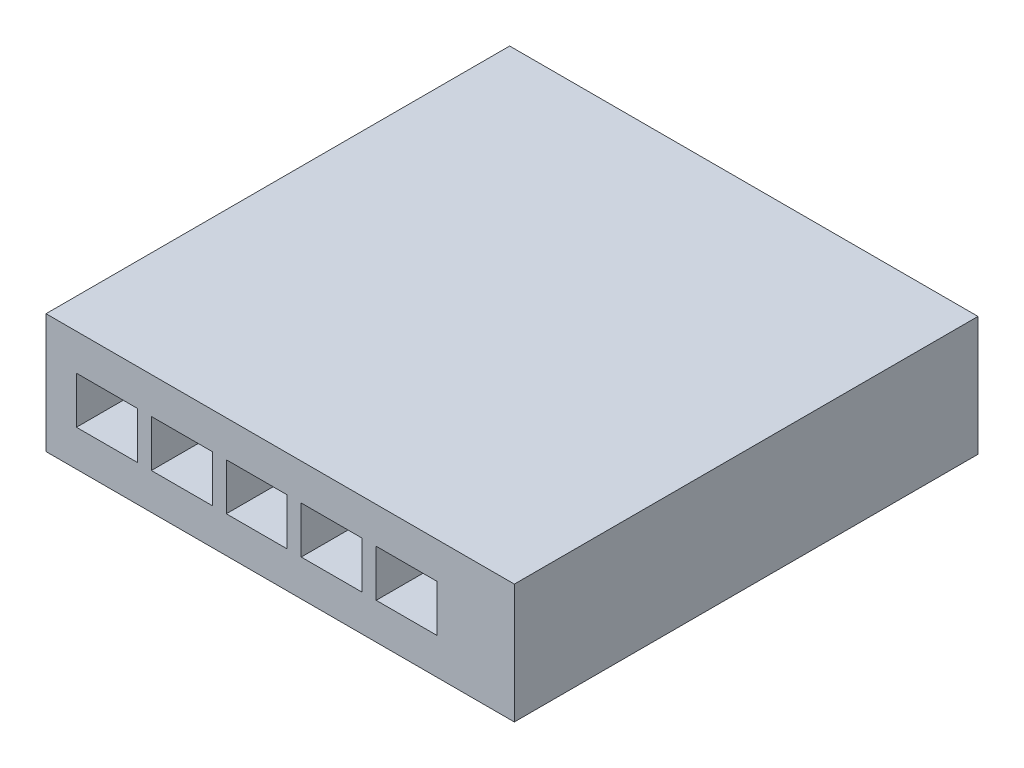
from build123d import *

# Parameters (mm, degrees)
SKETCH1_W           = 100
SKETCH1_H           = 99
BOSS_EXTRUDE1_DEPTH = 12.75
SKETCH2_W           = 13
SKETCH2_H           = 10
CUT_EXTRUDE1_DEPTH  = 20
LPATTERN1_COUNT     = 5
LPATTERN1_PITCH     = 16
SKETCH3_R           = 1.5
CUT_EXTRUDE2_DEPTH  = 10


with BuildPart() as part:
    # Sketch1 → Boss-Extrude1 (new, symmetric)
    with BuildSketch(Plane(origin=(0, 0, 0), x_dir=(1, 0, 0), z_dir=(0, 1, 0))):
        Rectangle(SKETCH1_W, SKETCH1_H)
    extrude(amount=BOSS_EXTRUDE1_DEPTH, both=True)

    # Sketch2 → Cut-Extrude1 (cut)
    with BuildSketch(Plane.XY.offset(49.5)):
        with Locations((-37, 0)):
            Rectangle(SKETCH2_W, SKETCH2_H)
    cut_extrude1 = extrude(amount=-CUT_EXTRUDE1_DEPTH, mode=Mode.SUBTRACT)

    # LPattern1: Cut-Extrude1 ×5
    with Locations(*[(i * LPATTERN1_PITCH, 0, 0) for i in range(1, LPATTERN1_COUNT)]):
        add(cut_extrude1, mode=Mode.SUBTRACT)

    # Sketch3 → Cut-Extrude2 (cut)
    with BuildSketch(Plane(origin=(0, 0, -49.5), x_dir=(-1, 0, 0), z_dir=(0, 0, -1))):
        with Locations((29, 0)):
            Circle(SKETCH3_R)
    extrude(amount=-CUT_EXTRUDE2_DEPTH, mode=Mode.SUBTRACT)


solid = part.part
